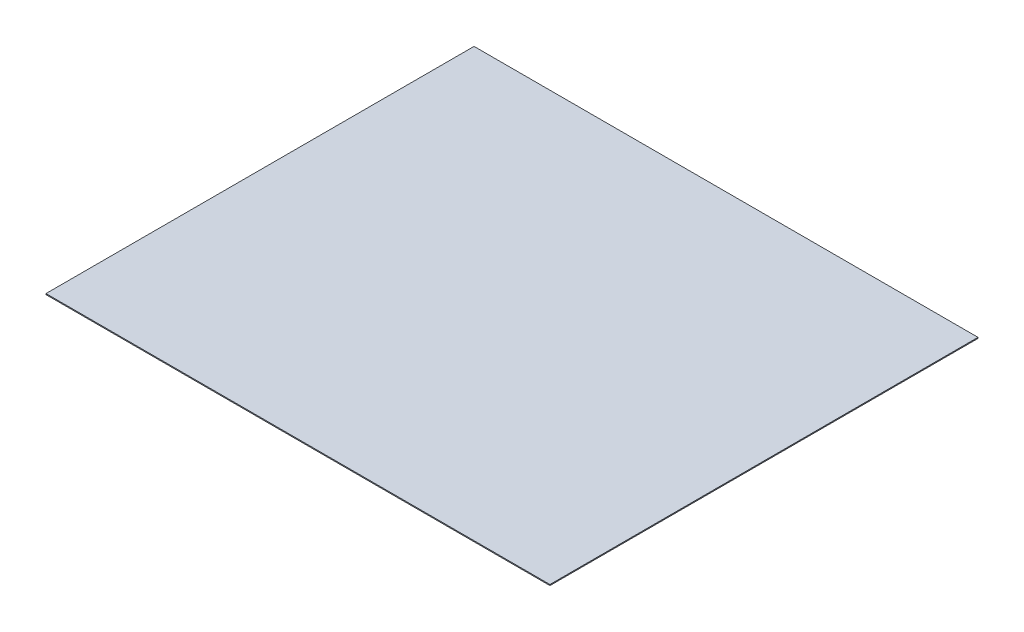
from build123d import *

# Parameters (mm, degrees)
CROQUIS1_W              = 1481.2
CROQUIS1_H              = 1258.2
SALIENTE_EXTRUIR1_DEPTH = 2.9


with BuildPart() as part:
    # Croquis1 → Saliente-Extruir1 (new body)
    with BuildSketch(Plane(origin=(0, 0, 0), x_dir=(1, 0, 0), z_dir=(0, 1, 0))):
        with Locations((740.6, -629.1)):
            Rectangle(CROQUIS1_W, CROQUIS1_H)
    extrude(amount=SALIENTE_EXTRUIR1_DEPTH)


solid = part.part
